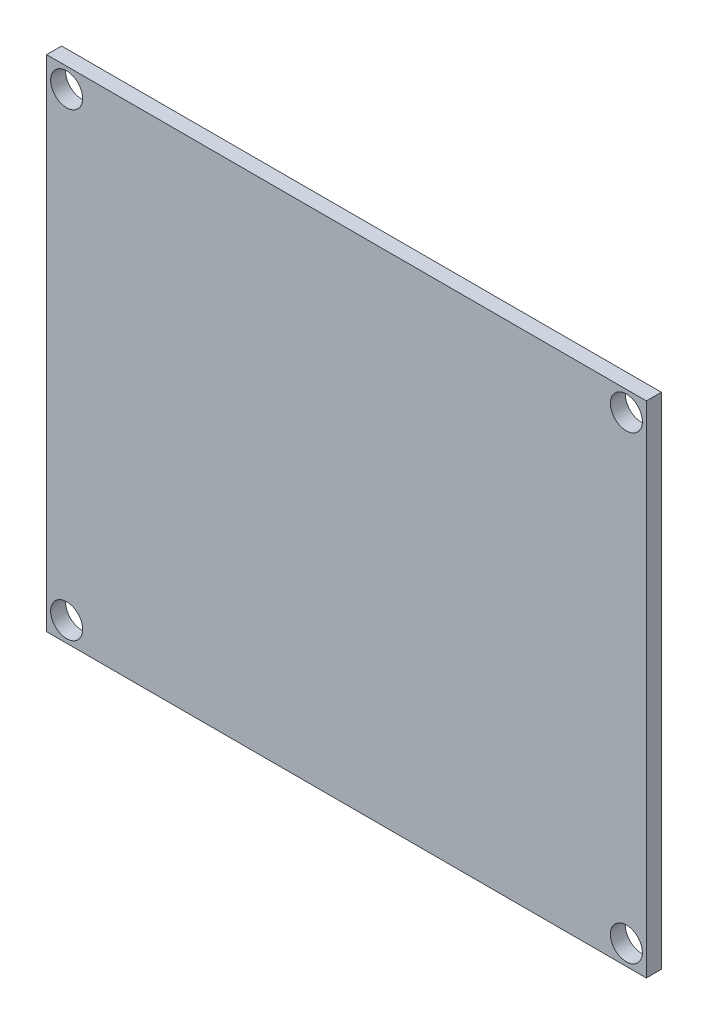
from build123d import *

# Parameters (mm, degrees)
SKETCH_1_W      = 60
SKETCH_1_H      = 50
SKETCH_1_R      = 1.6
EXTRUDE_1_DEPTH = 1.5


with BuildPart() as part:
    # 草图1 → 凸台-拉伸1 (new body)
    with BuildSketch(Plane.XY):
        Rectangle(SKETCH_1_W, SKETCH_1_H)
        with Locations((28, 23)):
            Circle(SKETCH_1_R, mode=Mode.SUBTRACT)
        with Locations((28, -23)):
            Circle(SKETCH_1_R, mode=Mode.SUBTRACT)
        with Locations((-28, 23)):
            Circle(SKETCH_1_R, mode=Mode.SUBTRACT)
        with Locations((-28, -23)):
            Circle(SKETCH_1_R, mode=Mode.SUBTRACT)
    extrude(amount=EXTRUDE_1_DEPTH)


solid = part.part
